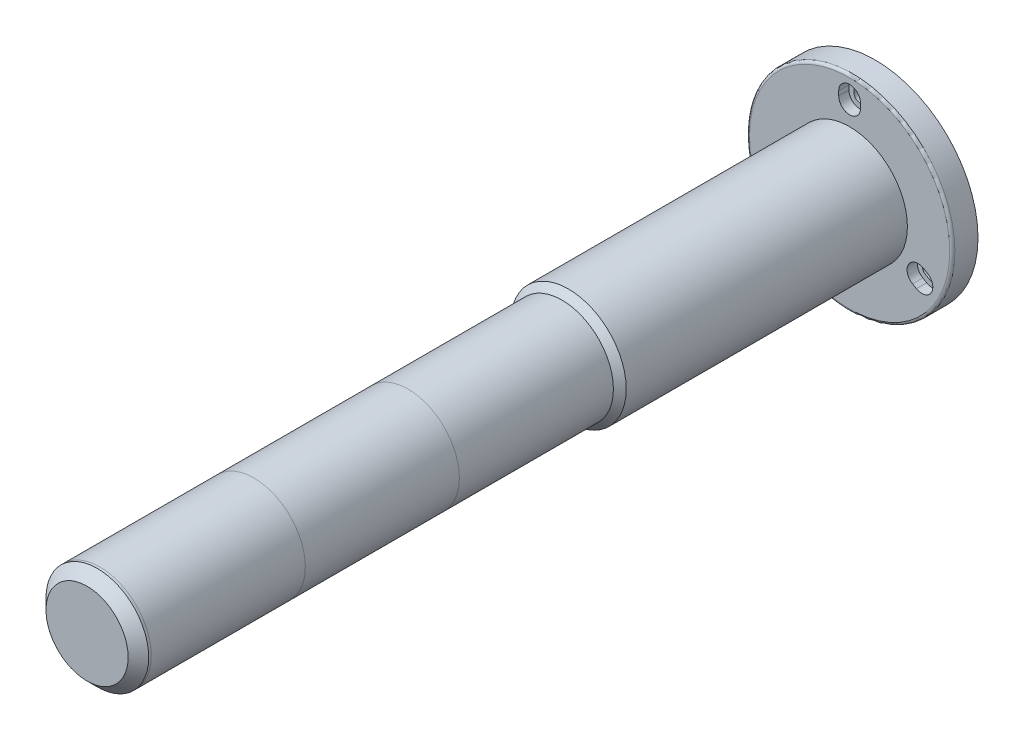
from build123d import *

# Parameters (mm, degrees)
SKETCH_1_R            = 40
EXTRUDE_1_DEPTH       = 10
FILLET_1_R            = 1
CUT_EXTRUDE_1_DEPTH   = 4
SKETCH_3_R            = 22.5
EXTRUDE_2_DEPTH       = 112
SKETCH_4_R            = 20
EXTRUDE_3_DEPTH       = 60
SKETCH_5_R            = 20
EXTRUDE_4_DEPTH       = 60
SKETCH_6_R            = 20
EXTRUDE_5_DEPTH       = 60
SKETCH_7_R            = 20
EXTRUDE_6_DEPTH       = 5
CHAMFER_1_SIZE        = 4
CHAMFER_2_SIZE        = 2.5
SKETCH_1_2_R          = 7.5
CUT_EXTRUDE_1_2_DEPTH = 10


with BuildPart() as part:
    # Sketch 1 → 伸長1 (new body)
    with BuildSketch(Plane.XY):
        Circle(SKETCH_1_R)
        with BuildLine():
            Line((2.25, 32.5), (2.25, 30.75))
            ThreePointArc((2.25, 30.75), (0, 28.5), (-2.25, 30.75))
            Line((-2.25, 30.75), (-2.25, 32.5))
            ThreePointArc((-2.25, 32.5), (0, 34.75), (2.25, 32.5))
        make_face(mode=Mode.SUBTRACT)
        with BuildLine():
            Line((29.270825623, -13.551442841), (27.755281166, -12.676442841))
            ThreePointArc((27.755281166, -12.676442841), (24.681724008, -13.5), (25.505281166, -16.573557159))
            Line((25.505281166, -16.573557159), (27.020825623, -17.448557159))
            ThreePointArc((27.020825623, -17.448557159), (30.094382782, -16.625), (29.270825623, -13.551442841))
        make_face(mode=Mode.SUBTRACT)
        with BuildLine():
            Line((-26.37130657, -17.823557159), (-24.855762114, -16.948557159))
            ThreePointArc((-24.855762114, -16.948557159), (-24.032204955, -13.875), (-27.105762114, -13.051442841))
            Line((-27.105762114, -13.051442841), (-28.62130657, -13.926442841))
            ThreePointArc((-28.62130657, -13.926442841), (-29.444863729, -17), (-26.37130657, -17.823557159))
        make_face(mode=Mode.SUBTRACT)
    extrude(amount=EXTRUDE_1_DEPTH)

    # 圓角1
    fillet_1_edges = [part.edges().sort_by_distance(p)[0] for p in [
        (-40, 0, 10),
    ]]
    fillet(fillet_1_edges, radius=FILLET_1_R)

    # 草圖2 → Cut-Extrude 1 (cut)
    with BuildSketch(Plane.XY.offset(10)):
        with BuildLine():
            Line((24.504931819, -18.249837648), (26.020476275, -19.124837648))
            ThreePointArc((26.020476275, -19.124837648), (31.826084242, -17.569229682), (30.270476275, -11.763621716))
            Line((30.270476275, -11.763621716), (28.754931819, -10.888621716))
            ThreePointArc((28.754931819, -10.888621716), (22.949323853, -12.444229682), (24.504931819, -18.249837648))
        make_face()
        with BuildLine():
            Line((4.25, 30.75), (4.25, 32.5))
            ThreePointArc((4.25, 32.5), (0, 36.75), (-4.25, 32.5))
            Line((-4.25, 32.5), (-4.25, 30.75))
            ThreePointArc((-4.25, 30.75), (0, 26.5), (4.25, 30.75))
        make_face()
        with BuildLine():
            Line((-28.057638275, -11.291204331), (-29.573182732, -12.166204331))
            ThreePointArc((-29.573182732, -12.166204331), (-31.128790698, -17.971812297), (-25.323182732, -19.527420263))
            Line((-25.323182732, -19.527420263), (-23.807638275, -18.652420263))
            ThreePointArc((-23.807638275, -18.652420263), (-22.252030309, -12.846812297), (-28.057638275, -11.291204331))
        make_face()
    extrude(amount=-CUT_EXTRUDE_1_DEPTH, mode=Mode.SUBTRACT)

    # Sketch 1 2 → Cut-Extrude 1 2 (cut)
    with BuildSketch(Plane(origin=(0, 0, 0), x_dir=(-1, 0, 0), z_dir=(0, 0, -1))):
        Circle(SKETCH_1_2_R)
    extrude(amount=-CUT_EXTRUDE_1_2_DEPTH, mode=Mode.SUBTRACT)


with BuildPart() as body_2:
    # 草圖3 → 伸長2 (new body)
    with BuildSketch(Plane.XY.offset(10)):
        Circle(SKETCH_3_R)
    extrude(amount=EXTRUDE_2_DEPTH)

    # 導角2
    chamfer_2_edges = [body_2.edges().sort_by_distance(p)[0] for p in [
        (-22.5, 0, 122),
    ]]
    chamfer(chamfer_2_edges, length=CHAMFER_2_SIZE)


with BuildPart() as body_3:
    # 草圖4 → 伸長3 (new body)
    with BuildSketch(Plane.XY.offset(122)):
        Circle(SKETCH_4_R)
    extrude(amount=EXTRUDE_3_DEPTH)


with BuildPart() as body_4:
    # 草圖5 → 伸長4 (new body)
    with BuildSketch(Plane.XY.offset(182)):
        Circle(SKETCH_5_R)
    extrude(amount=EXTRUDE_4_DEPTH)


with BuildPart() as body_5:
    # 草圖6 → 伸長5 (new body)
    with BuildSketch(Plane.XY.offset(242)):
        Circle(SKETCH_6_R)
    extrude(amount=EXTRUDE_5_DEPTH)


with BuildPart() as body_6:
    # 草圖7 → 伸長6 (new body)
    with BuildSketch(Plane.XY.offset(302)):
        Circle(SKETCH_7_R)
    extrude(amount=EXTRUDE_6_DEPTH)

    # 導角1
    chamfer_1_edges = [body_6.edges().sort_by_distance(p)[0] for p in [
        (-20, 0, 307),
    ]]
    chamfer(chamfer_1_edges, length=CHAMFER_1_SIZE)


solid = Compound([part.part, body_2.part, body_3.part, body_4.part, body_5.part, body_6.part])
